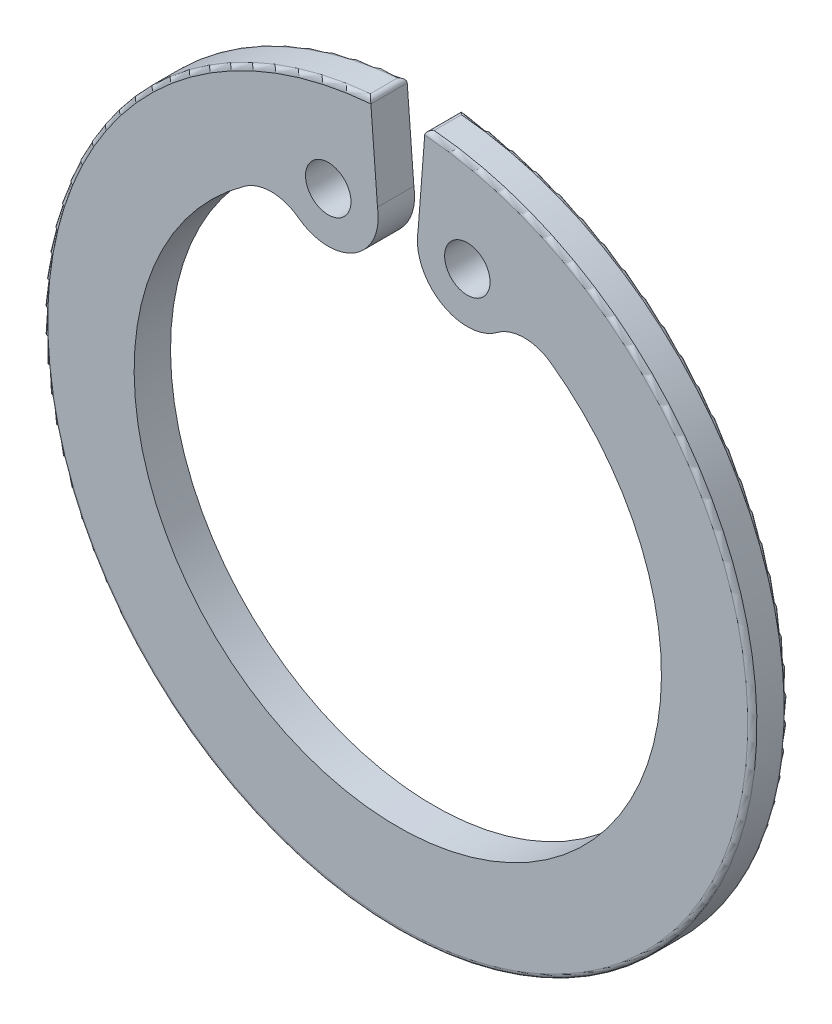
from build123d import *

# Parameters (mm, degrees)
BOSS_EXTRUDE1_DEPTH      = 1
BOSS_EXTRUDE1_DEPTH_BACK = 1
BOSS_EXTRUDE2_START      = -1
SKETCH2_R                = 2.75
SKETCH2_R_2              = 1.25
BOSS_EXTRUDE2_DEPTH      = 2
FILLET1_R                = 2.5
CUT_EXTRUDE1_DEPTH       = 28.595289598
CUT_EXTRUDE1_DEPTH_BACK  = 28.595289598
SKETCH2_2_R              = 1.25
FILLET4_R                = 0.25


with BuildPart() as part:
    # Sketch1 → Boss-Extrude1 (new, two sides: drawn at the far end of the back side and taken through both)
    with BuildSketch(Plane.XY.offset(-BOSS_EXTRUDE1_DEPTH_BACK)):
        with BuildLine():
            ThreePointArc((19.5, 0), (14.309088021, 13.247641299), (1.5, 19.442222095))
            Line((1.5, 19.442222095), (1.115384615, 14.457036943))
            ThreePointArc((1.115384615, 14.457036943), (10.640091093, 9.850810197), (14.5, 0))
            ThreePointArc((14.5, 0), (-9.850810197, -10.640091093), (-1.115384615, 14.457036943))
            Line((-1.115384615, 14.457036943), (-1.5, 19.442222095))
            ThreePointArc((-1.5, 19.442222095), (-13.247641299, -14.309088021), (19.5, 0))
        make_face()
    extrude(amount=BOSS_EXTRUDE1_DEPTH + BOSS_EXTRUDE1_DEPTH_BACK)

    # Sketch2 → Boss-Extrude2 (add)
    # profile 1 of 2: a face of its own
    with BuildSketch(Plane.XY.offset(BOSS_EXTRUDE2_START)):
        with Locations((-3.824821191, 13.986448543)):
            Circle(SKETCH2_R)
        with Locations((-3.824821191, 13.986448543)):
            Circle(SKETCH2_R_2, mode=Mode.SUBTRACT)
    # profile 2 of 2: a face of its own
    with BuildSketch(Plane.XY.offset(BOSS_EXTRUDE2_START)):
        with Locations((3.824821191, 13.986448543)):
            Circle(SKETCH2_R)
        with Locations((3.824821191, 13.986448543)):
            Circle(SKETCH2_R_2, mode=Mode.SUBTRACT)
    extrude(amount=BOSS_EXTRUDE2_DEPTH)

    # Fillet1
    fillet1_edges = [part.edges().sort_by_distance(p)[0] for p in [
        (-6.396682451, 13.012780396, 0),
        (6.396682451, 13.012780396, 0),
    ]]
    fillet(fillet1_edges, radius=FILLET1_R)

    # Sketch2<2> → Cut-Extrude1 (cut, two sides: drawn at the far end of the back side and taken through both)
    with BuildSketch(Plane.XY.offset(-CUT_EXTRUDE1_DEPTH_BACK)):
        with Locations((-3.824821191, 13.986448543)):
            Circle(SKETCH2_2_R)
        with Locations((3.824821191, 13.986448543)):
            Circle(SKETCH2_2_R)
    extrude(amount=CUT_EXTRUDE1_DEPTH + CUT_EXTRUDE1_DEPTH_BACK, mode=Mode.SUBTRACT)

    # Fillet4
    fillet4_edges = [part.edges().sort_by_distance(p)[0] for p in [
        (0, -19.5, 1),
        (0, -19.5, -1),
        (1.5, 19.442222095, 0),
        (-1.5, 19.442222095, 0),
    ]]
    fillet(fillet4_edges, radius=FILLET4_R)


solid = part.part
